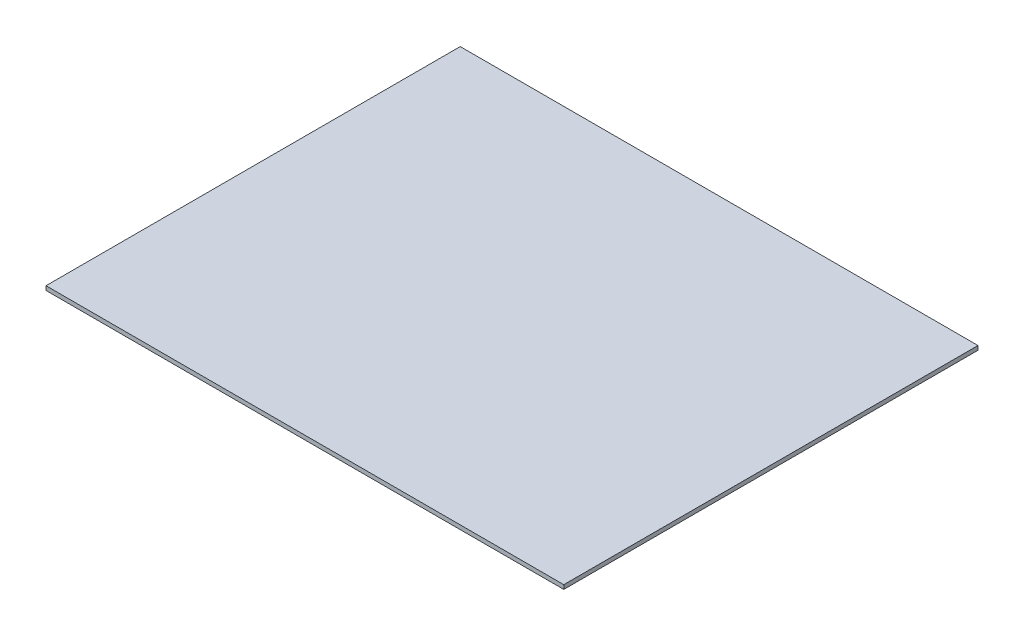
from build123d import *

# Parameters (mm, degrees)
SKETCH1_W           = 254
SKETCH1_H           = 203.2
BOSS_EXTRUDE1_DEPTH = 2.032


with BuildPart() as part:
    # Sketch1 → Boss-Extrude1 (new body)
    with BuildSketch(Plane(origin=(0, 0, 0), x_dir=(1, 0, 0), z_dir=(0, 1, 0))):
        Rectangle(SKETCH1_W, SKETCH1_H)
    extrude(amount=BOSS_EXTRUDE1_DEPTH)


solid = part.part
